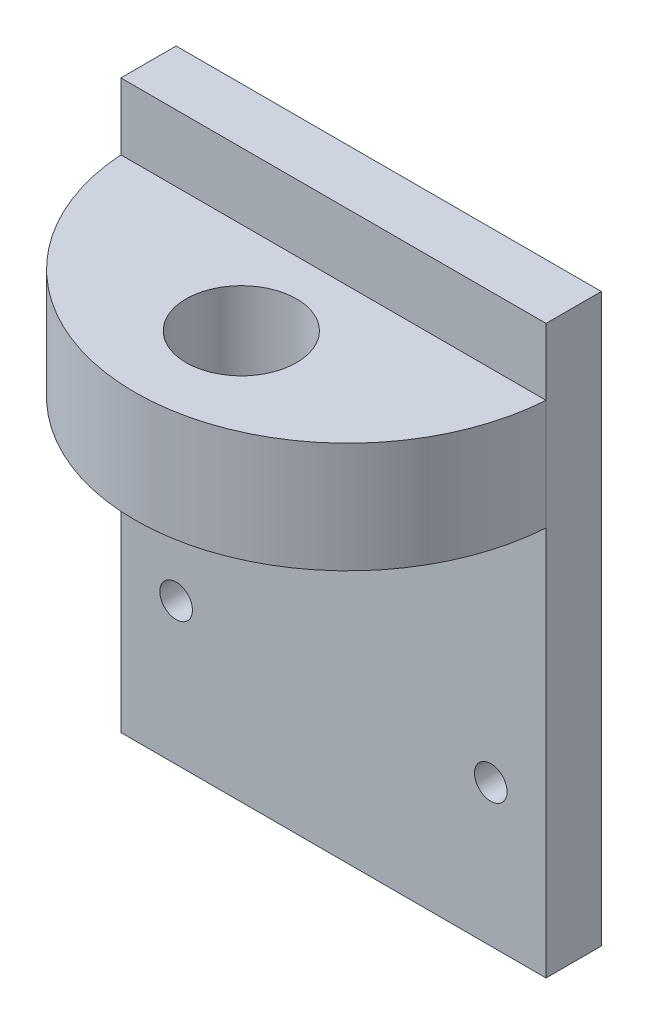
from build123d import *

# Parameters (mm, degrees)
BOSS_EXTRUDE1_DEPTH = 19.812
SKETCH2_R           = 2.921
BOSS_EXTRUDE2_DEPTH = 9.906


with BuildPart() as part:
    # Sketch1 → Boss-Extrude1 (new body)
    with BuildSketch(Plane(origin=(0, 0, 0), x_dir=(1, 0, 0), z_dir=(0, 1, 0))):
        with BuildLine():
            ThreePointArc((-38.1, -35.603754118), (-12.026846627, -25.317436869), (0, 0))
            Line((0, 0), (-38.1, 0))
            Line((-38.1, 0), (-38.1, -6.604))
            ThreePointArc((-38.1, -6.604), (-31.095400226, -9.505400226), (-28.194, -16.51))
            ThreePointArc((-28.194, -16.51), (-31.095400226, -23.514599774), (-38.1, -26.416))
            Line((-38.1, -26.416), (-38.1, -35.603754118))
        make_face()
        with BuildLine():
            Line((-38.1, -6.604), (-38.1, 0))
            Line((-38.1, 0), (-76.2, 0))
            ThreePointArc((-76.2, 0), (-64.173153373, -25.317436869), (-38.1, -35.603754118))
            Line((-38.1, -35.603754118), (-38.1, -26.416))
            ThreePointArc((-38.1, -26.416), (-48.006, -16.51), (-38.1, -6.604))
        make_face()
    extrude(amount=BOSS_EXTRUDE1_DEPTH)

    # Sketch2 → Boss-Extrude2 (add)
    with BuildSketch(Plane(origin=(0, 0, 0), x_dir=(-1, 0, 0), z_dir=(0, 0, -1))):
        Polygon((0, 0), (0, -69.85), (76.2, -69.85), (76.2, 0), (76.2, 31.75), (0, 31.75), align=None)
        with Locations((9.906, -44.45)):
            Circle(SKETCH2_R, mode=Mode.SUBTRACT)
        with Locations((66.294, -44.45)):
            Circle(SKETCH2_R, mode=Mode.SUBTRACT)
    extrude(amount=BOSS_EXTRUDE2_DEPTH)


solid = part.part
